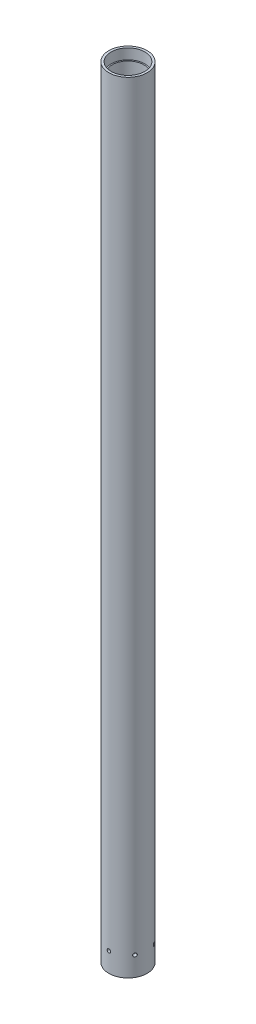
from build123d import *

# Parameters (mm, degrees)
SKETCH1_R           = 14.75
SKETCH1_R_2         = 12
BOSS_EXTRUDE1_DEPTH = 600
SKETCH4_R           = 1.325
CUT_EXTRUDE2_DEPTH  = 10
CIRPATTERN2_COUNT   = 4
CIRPATTERN2_ANGLE   = 180
SKETCH5_R           = 13
SKETCH5_R_2         = 12
CUT_EXTRUDE3_DEPTH  = 8
LPATTERN1_COUNT     = 2
LPATTERN1_PITCH     = 592


with BuildPart() as part:
    # Sketch1 → Boss-Extrude1 (new body)
    with BuildSketch(Plane(origin=(0, 0, 0), x_dir=(1, 0, 0), z_dir=(0, 1, 0))):
        with Locations(Location((0, 0, 0), (0, 0, 270))):
            Circle(SKETCH1_R)
        with Locations(Location((0, 0, 0), (0, 0, 270))):
            Circle(SKETCH1_R_2, mode=Mode.SUBTRACT)
    extrude(amount=BOSS_EXTRUDE1_DEPTH)

    # Sketch4 → Cut-Extrude2 (cut)
    with BuildSketch(Plane.XY.offset(14.75)):
        with Locations((0, 15)):
            Circle(SKETCH4_R)
    cut_extrude2 = extrude(amount=-CUT_EXTRUDE2_DEPTH, mode=Mode.SUBTRACT)

    # CirPattern2: Cut-Extrude2 ×4 about axis
    cirpattern2_axis = Axis((0, 600, 0), (0, 1, 0))
    for i in range(1, CIRPATTERN2_COUNT):
        add(cut_extrude2.rotate(cirpattern2_axis, i * CIRPATTERN2_ANGLE / (CIRPATTERN2_COUNT - 1)), mode=Mode.SUBTRACT)

    # Sketch5 → Cut-Extrude3 (cut)
    with BuildSketch(Plane.XZ):
        with Locations(Location((0, 0, 0), (0, 0, 270))):
            Circle(SKETCH5_R)
        with Locations(Location((0, 0, 0), (0, 0, 270))):
            Circle(SKETCH5_R_2, mode=Mode.SUBTRACT)
    cut_extrude3 = extrude(amount=-CUT_EXTRUDE3_DEPTH, mode=Mode.SUBTRACT)

    # LPattern1: Cut-Extrude3 ×2
    with Locations(*[(0, i * LPATTERN1_PITCH, 0) for i in range(1, LPATTERN1_COUNT)]):
        add(cut_extrude3, mode=Mode.SUBTRACT)


solid = part.part
